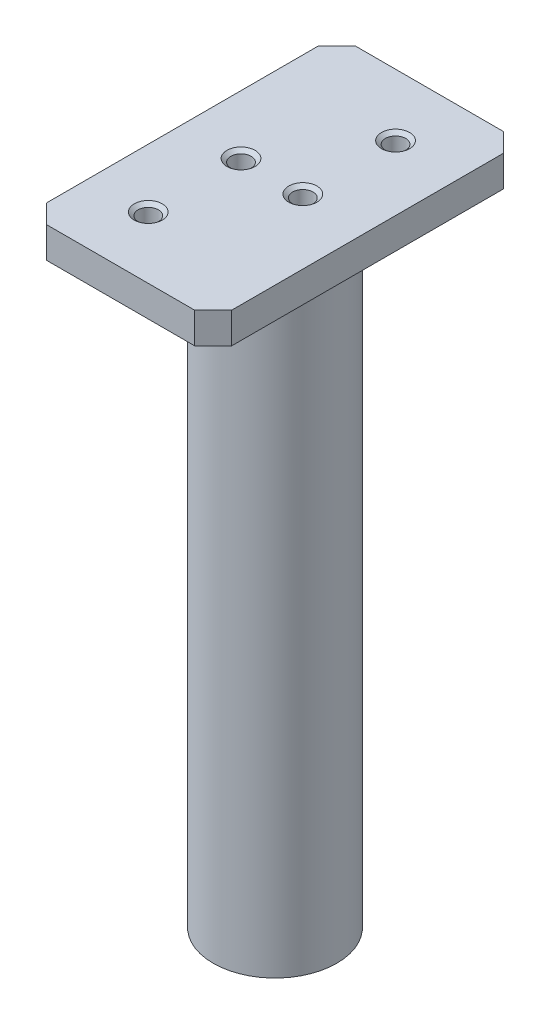
from build123d import *

# Parameters (mm, degrees)
SKETCH1_W                       = 30
SKETCH1_H                       = 50
BOSS_EXTRUDE1_DEPTH             = 5
M4X0_7_TAPPED_HOLE1_D           = 3.3
M4X0_7_TAPPED_HOLE1_CSINK_D     = 4.55
M4X0_7_TAPPED_HOLE1_CSINK_ANGLE = 100
SKETCH4_R                       = 10
BOSS_EXTRUDE2_DEPTH             = 100
CHAMFER1_SIZE                   = 3


with BuildPart() as part:
    # Sketch1 → Boss-Extrude1 (new body)
    with BuildSketch(Plane(origin=(0, 0, 0), x_dir=(1, 0, 0), z_dir=(0, 1, 0))):
        Rectangle(SKETCH1_W, SKETCH1_H)
    extrude(amount=BOSS_EXTRUDE1_DEPTH)

    # M4x0.7 Tapped Hole1 (through all)
    with Locations(Plane(origin=(0, 5, 0), x_dir=(1, 0, 0), z_dir=(0, 1, 0))):
        with Locations((-5.5, -15), (-5.5, 0), (4.5, 0), (4.5, 15)):
            CounterSinkHole(M4X0_7_TAPPED_HOLE1_D / 2, M4X0_7_TAPPED_HOLE1_CSINK_D / 2, counter_sink_angle=M4X0_7_TAPPED_HOLE1_CSINK_ANGLE)

    # Sketch4 → Boss-Extrude2 (add)
    with BuildSketch(Plane.XZ):
        with Locations(Location((0, 0, 0), (0, 0, 90))):
            Circle(SKETCH4_R)
    extrude(amount=BOSS_EXTRUDE2_DEPTH)

    # Chamfer1
    chamfer1_edges = [part.edges().sort_by_distance(p)[0] for p in [
        (15, 2.5, 25),
        (-15, 2.5, 25),
        (-15, 2.5, -25),
        (15, 2.5, -25),
    ]]
    chamfer(chamfer1_edges, length=CHAMFER1_SIZE)


solid = part.part
